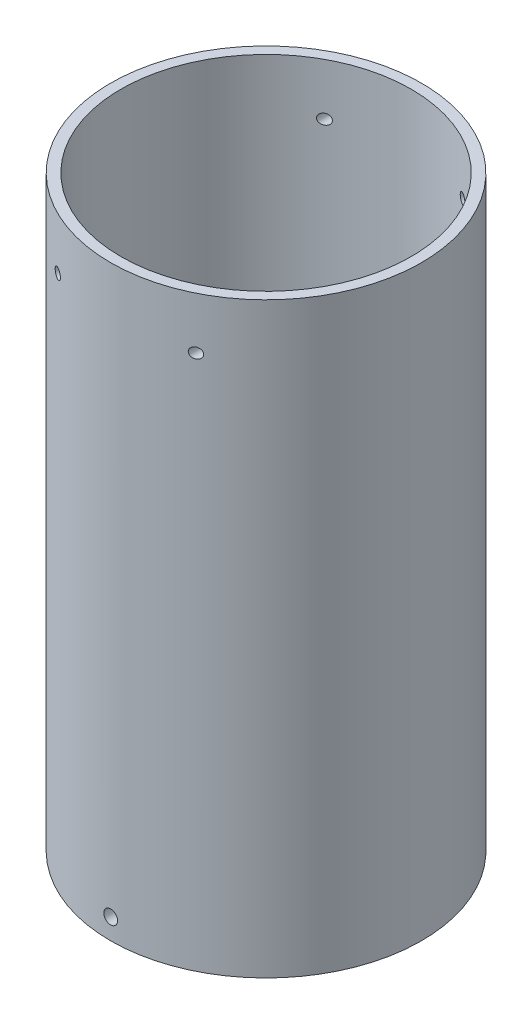
from build123d import *

# Parameters (mm, degrees)
SKETCH1_R               = 45
SKETCH1_R_2             = 42
BOSS_EXTRUDE1_DEPTH     = 170
CUT_EXTRUDE1_DEPTH      = 182.521348607
CUT_EXTRUDE1_DEPTH_BACK = 182.521348607
SKETCH2_R               = 2
SKETCH2_R_2             = 1.5


with BuildPart() as part:
    # Sketch1 → Boss-Extrude1 (new body)
    with BuildSketch(Plane(origin=(0, 0, 0), x_dir=(1, 0, 0), z_dir=(0, 1, 0))):
        with Locations(Location((0, 0, 0), (0, 0, 270))):
            Circle(SKETCH1_R)
        with Locations(Location((0, 0, 0), (0, 0, 270))):
            Circle(SKETCH1_R_2, mode=Mode.SUBTRACT)
    extrude(amount=-BOSS_EXTRUDE1_DEPTH)

    # Sketch2 → Cut-Extrude1 (cut, two sides: drawn at the far end of the back side and taken through both)
    with BuildSketch(Plane.XY.offset(-CUT_EXTRUDE1_DEPTH_BACK)):
        with Locations((0, -164)):
            Circle(SKETCH2_R)
        with Locations((-20, -15)):
            Circle(SKETCH2_R_2)
        with Locations((20, -15)):
            Circle(SKETCH2_R_2)
    extrude(amount=CUT_EXTRUDE1_DEPTH + CUT_EXTRUDE1_DEPTH_BACK, mode=Mode.SUBTRACT)


solid = part.part
